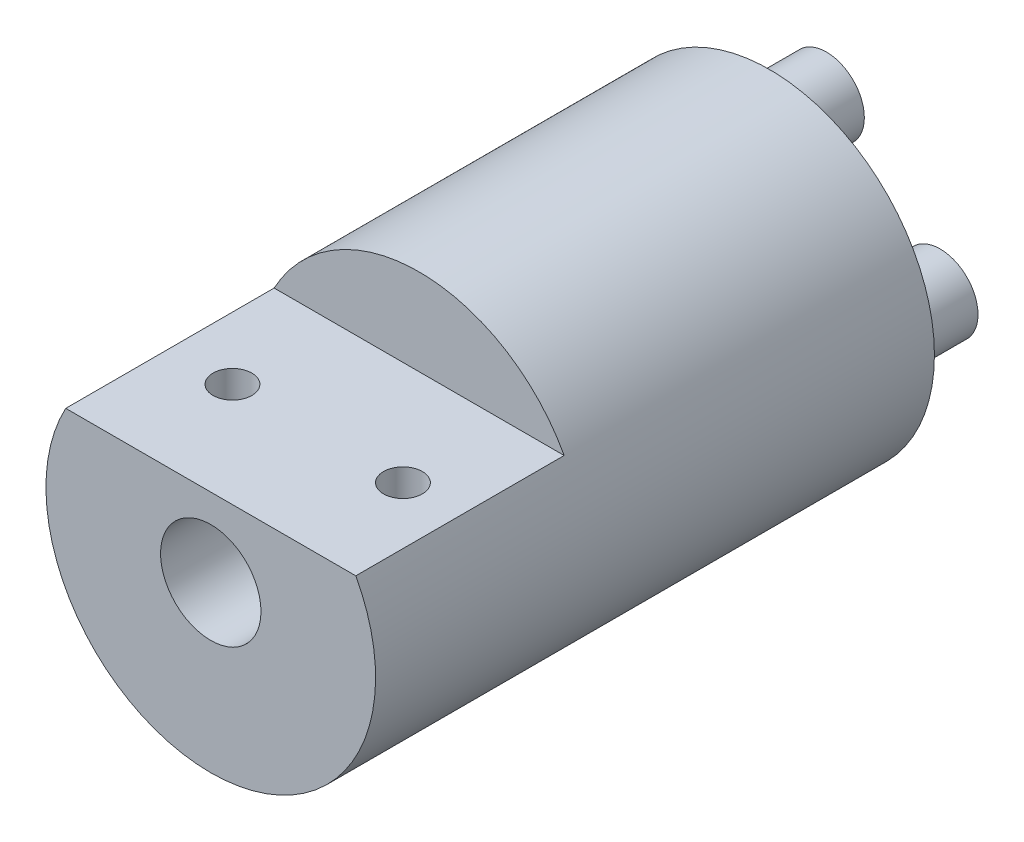
from build123d import *

# Parameters (mm, degrees)
SKETCH1_R                      = 8.7
BOSS_EXTRUDE1_DEPTH            = 29.5
SKETCH5_R                      = 1.75
CUT_EXTRUDE1_DEPTH             = 32.962947298
SKETCH6_R                      = 2.65
CUT_EXTRUDE3_DEPTH             = 20.9
SKETCH2_W                      = 17
SKETCH2_H                      = 4.566888769
CUT_EXTRUDE4_DEPTH             = 11
FILLET1_R                      = 0.3
TAP_DRILL_FOR_M2_5X0_45_TAP1_D = 2.05
SKETCH4_R                      = 2
BOSS_EXTRUDE2_DEPTH            = 3


with BuildPart() as part:
    # Sketch1 → Boss-Extrude1 (new body)
    with BuildSketch(Plane.XY):
        Circle(SKETCH1_R)
    extrude(amount=BOSS_EXTRUDE1_DEPTH)

    # Sketch5 → Cut-Extrude1 (cut, through all)
    with BuildSketch(Plane(origin=(0, 0, 0), x_dir=(-1, 0, 0), z_dir=(0, 0, -1))):
        Circle(SKETCH5_R)
    extrude(amount=-CUT_EXTRUDE1_DEPTH, mode=Mode.SUBTRACT)

    # Sketch6 → Cut-Extrude3 (cut)
    with BuildSketch(Plane.XY.offset(29.5)):
        Circle(SKETCH6_R)
    extrude(amount=-CUT_EXTRUDE3_DEPTH, mode=Mode.SUBTRACT)

    # Sketch2 → Cut-Extrude4 (cut)
    with BuildSketch(Plane.XY.offset(29.5)):
        with Locations((0.844453543, 6.416555616)):
            Rectangle(SKETCH2_W, SKETCH2_H)
    extrude(amount=-CUT_EXTRUDE4_DEPTH, mode=Mode.SUBTRACT)

    # Fillet1
    fillet1_edges = [part.edges().sort_by_distance(p)[0] for p in [
        (1.75, 0, 8.6),
    ]]
    fillet(fillet1_edges, radius=FILLET1_R)

    # Tap Drill for M2.5x0.45 Tap1 (through all)
    with Locations(Plane(origin=(0, 4.133111231, 0), x_dir=(1, 0, 0), z_dir=(0, 1, 0))):
        with Locations((4.644453543, -24), (-4.355546457, -24)):
            Hole(TAP_DRILL_FOR_M2_5X0_45_TAP1_D / 2)

    # Sketch4 → Boss-Extrude2 (add)
    with BuildSketch(Plane(origin=(0, 0, 0), x_dir=(-1, 0, 0), z_dir=(0, 0, -1))):
        with Locations(Location((0, 6, 0), (0, 0, 180))):
            Circle(SKETCH4_R)
        with Locations(Location((6, 0, 0), (0, 0, 180))):
            Circle(SKETCH4_R)
        with Locations(Location((0, -6, 0), (0, 0, 180))):
            Circle(SKETCH4_R)
        with Locations(Location((-6, 0, 0), (0, 0, 180))):
            Circle(SKETCH4_R)
    extrude(amount=BOSS_EXTRUDE2_DEPTH)


solid = part.part
